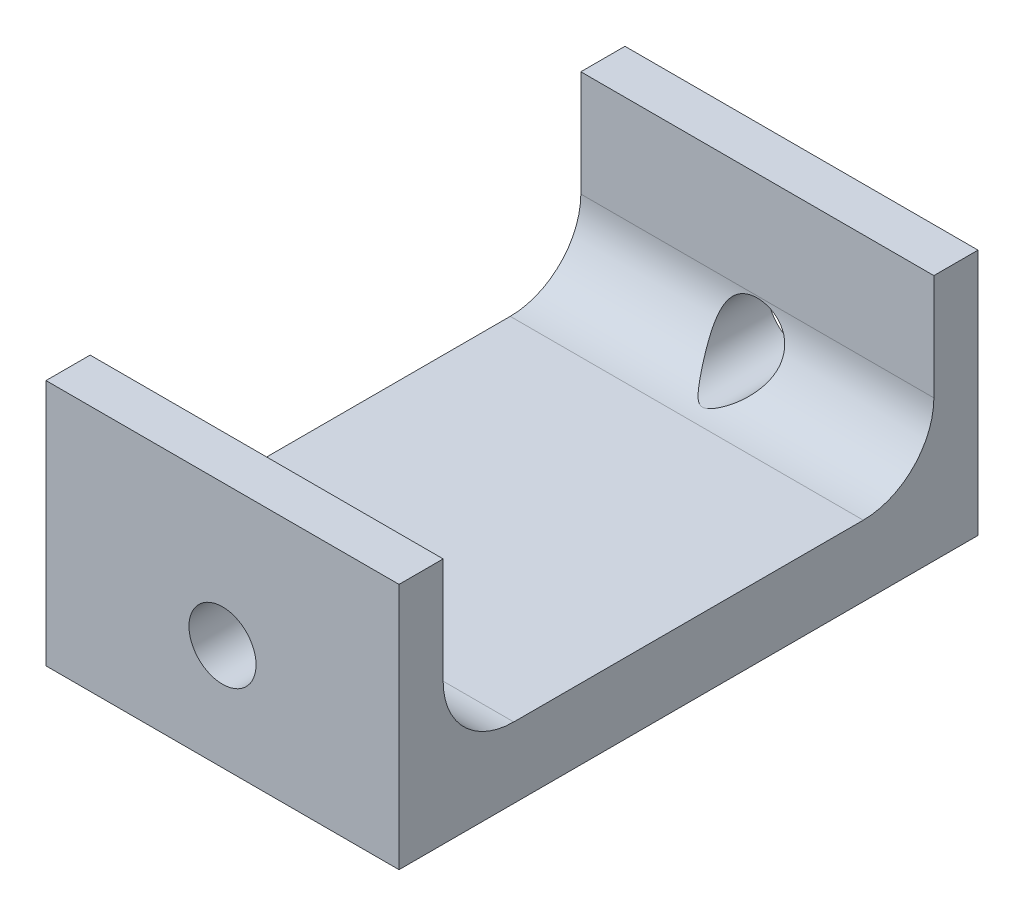
from build123d import *

# Parameters (mm, degrees)
CROQUIS1_W              = 20
CROQUIS1_H              = 14
SALIENTE_EXTRUIR1_DEPTH = 32.8
CROQUIS2_W              = 20
CROQUIS2_H              = 27.8
CORTAR_EXTRUIR2_DEPTH   = 10
REDONDEO1_R             = 4
CROQUIS3_R              = 1.9
CORTAR_EXTRUIR3_DEPTH   = 36


with BuildPart() as part:
    # Croquis1 → Saliente-Extruir1 (new body)
    with BuildSketch(Plane.XY):
        Rectangle(CROQUIS1_W, CROQUIS1_H)
    extrude(amount=SALIENTE_EXTRUIR1_DEPTH)

    # Croquis2 → Cortar-Extruir2 (cut)
    with BuildSketch(Plane(origin=(0, 7, 0), x_dir=(1, 0, 0), z_dir=(0, 1, 0))):
        with Locations((0, -16.4)):
            Rectangle(CROQUIS2_W, CROQUIS2_H)
    extrude(amount=-CORTAR_EXTRUIR2_DEPTH, mode=Mode.SUBTRACT)

    # Redondeo1
    redondeo1_edges = [part.edges().sort_by_distance(p)[0] for p in [
        (0, -3, 2.5),
        (0, -3, 30.3),
    ]]
    fillet(redondeo1_edges, radius=REDONDEO1_R)

    # Croquis3 → Cortar-Extruir3 (cut)
    with BuildSketch(Plane(origin=(0, 0, 0), x_dir=(-1, 0, 0), z_dir=(0, 0, -1))):
        with Locations((0, -1)):
            Circle(CROQUIS3_R)
    extrude(amount=-CORTAR_EXTRUIR3_DEPTH, mode=Mode.SUBTRACT)


solid = part.part
